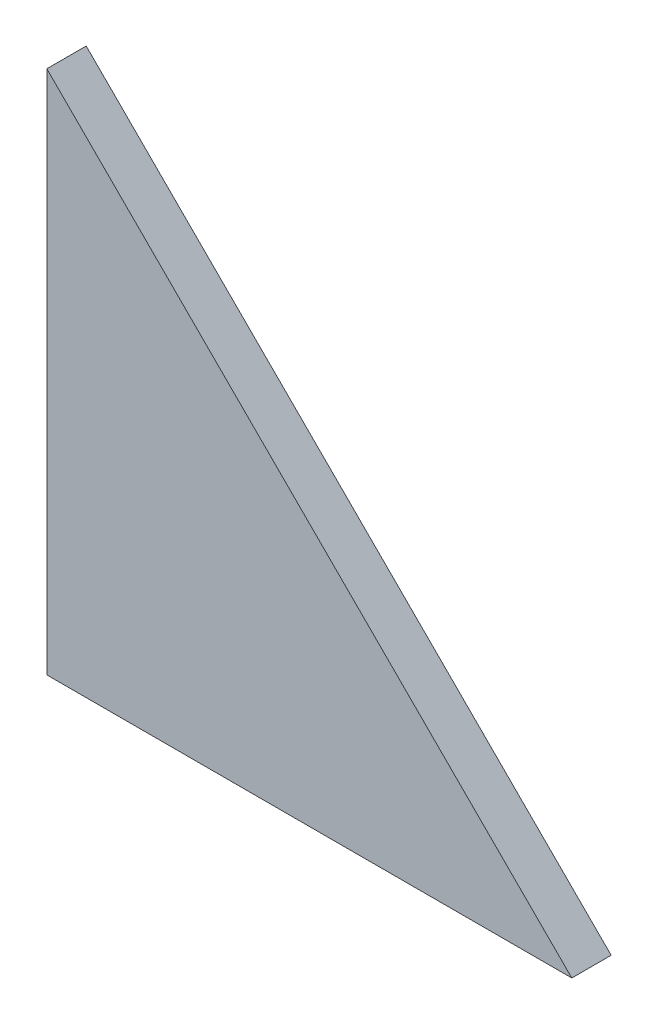
from build123d import *

# Parameters (mm, degrees)
ESBO_O1_W                  = 20
ESBO_O1_H                  = 20
RESSALTO_EXTRUS_O1_DEPTH   = 1.5
CORTE_EXTRUS_O1_DEPTH      = 29.324018077
CORTE_EXTRUS_O1_DEPTH_BACK = 29.324018077


with BuildPart() as part:
    # Esboço1 → Ressalto-extrusão1 (new body)
    with BuildSketch(Plane.XY):
        with Locations((10, 10)):
            Rectangle(ESBO_O1_W, ESBO_O1_H)
    extrude(amount=RESSALTO_EXTRUS_O1_DEPTH)

    # Esboço2 → Corte-extrusão1 (cut, two sides: drawn at the far end of the back side and taken through both)
    with BuildSketch(Plane.XY.offset(1.5).offset(-CORTE_EXTRUS_O1_DEPTH_BACK)):
        Polygon((-47.071067812, 67.071067812), (0, 20), (20, 0), (67.071067812, -47.071067812), (161.213203436, 47.071067812), (47.071067812, 161.213203436), align=None)
    extrude(amount=CORTE_EXTRUS_O1_DEPTH + CORTE_EXTRUS_O1_DEPTH_BACK, mode=Mode.SUBTRACT)


solid = part.part
